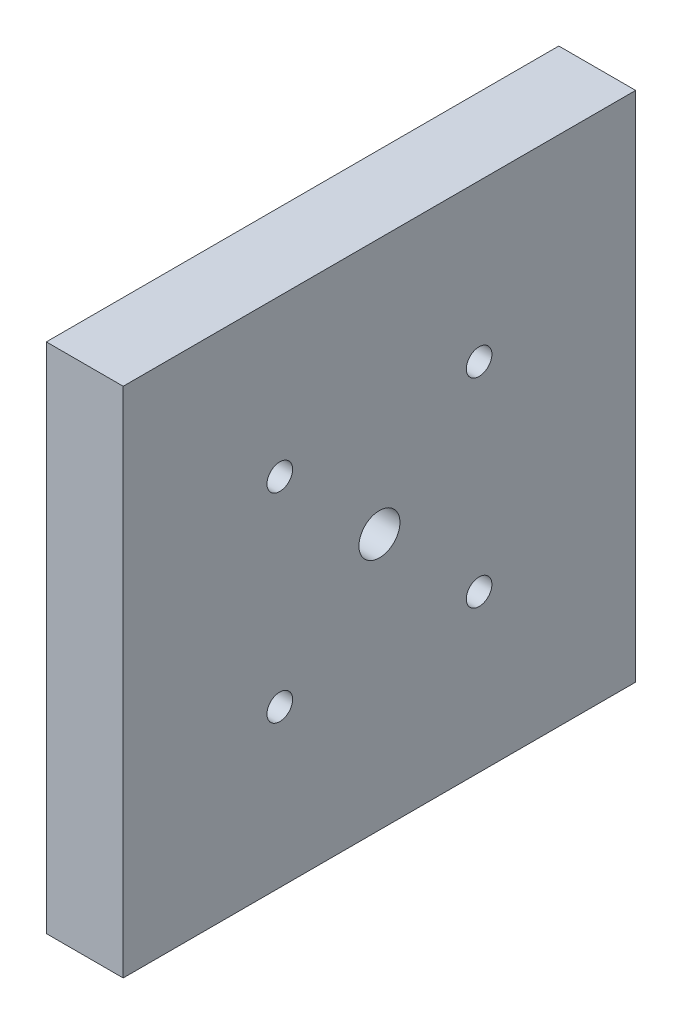
from build123d import *

# Parameters (mm, degrees)
SKETCH2_W           = 100
SKETCH2_H           = 100
SKETCH2_R           = 4
BOSS_EXTRUDE1_DEPTH = 15
SKETCH3_R           = 2.5
CUT_EXTRUDE1_DEPTH  = 15


with BuildPart() as part:
    # Sketch2 → Boss-Extrude1 (new body)
    with BuildSketch(Plane(origin=(0, 0, 0), x_dir=(0, 0, -1), z_dir=(1, 0, 0))):
        Rectangle(SKETCH2_W, SKETCH2_H)
        Circle(SKETCH2_R, mode=Mode.SUBTRACT)
    extrude(amount=BOSS_EXTRUDE1_DEPTH)

    # Sketch3 → Cut-Extrude1 (cut)
    with BuildSketch(Plane(origin=(15, 0, 0), x_dir=(0, 0, -1), z_dir=(1, 0, 0))):
        with Locations((-19.445436483, 19.445436483)):
            Circle(SKETCH3_R)
        with Locations((19.445436483, 19.445436483)):
            Circle(SKETCH3_R)
        with Locations((19.445436483, -19.445436483)):
            Circle(SKETCH3_R)
        with Locations((-19.445436483, -19.445436483)):
            Circle(SKETCH3_R)
    extrude(amount=-CUT_EXTRUDE1_DEPTH, mode=Mode.SUBTRACT)


solid = part.part
